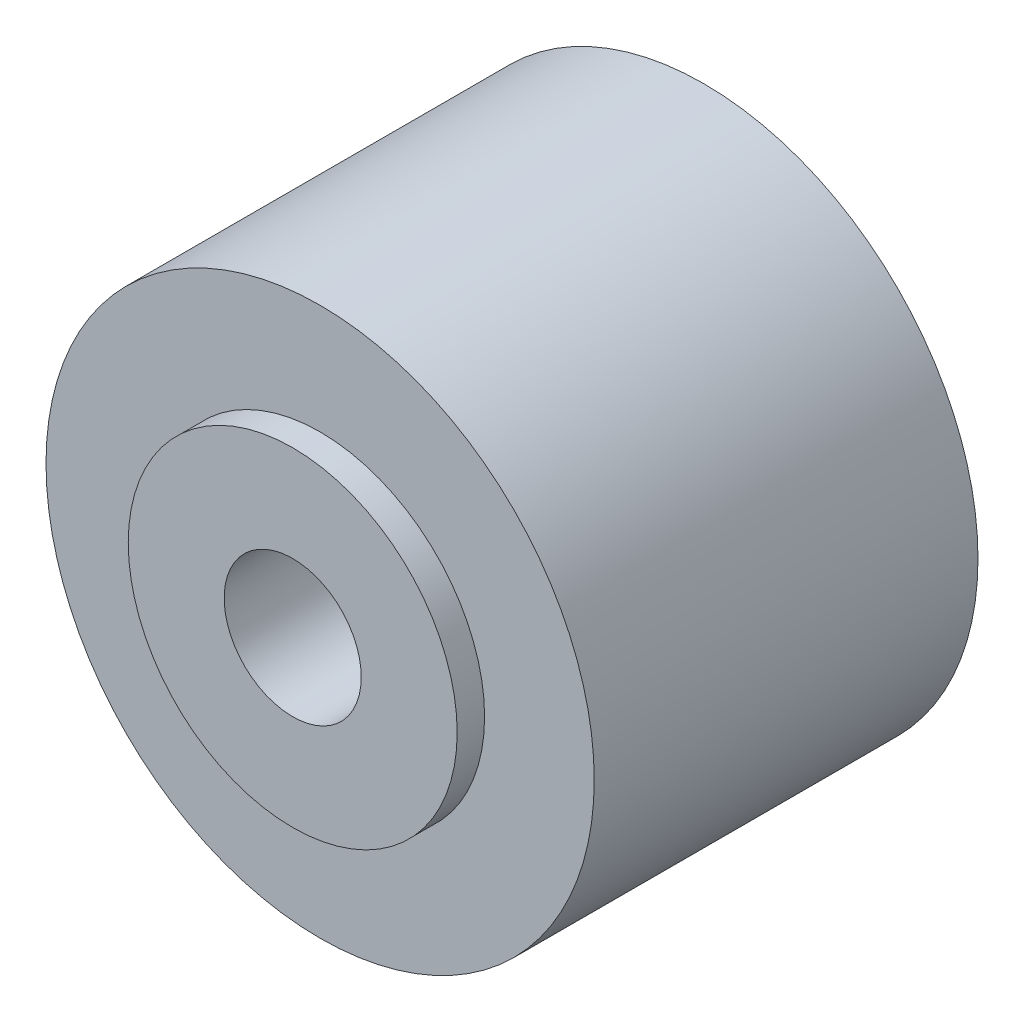
from build123d import *

# Parameters (mm, degrees)
SKETCH1_R           = 3
SKETCH1_R_2         = 1.25
BOSS_EXTRUDE1_DEPTH = 4
SKETCH2_R           = 5
SKETCH2_R_2         = 3
BOSS_EXTRUDE2_DEPTH = 3.5


with BuildPart() as part:
    # Sketch1 → Boss-Extrude1 (new, symmetric)
    with BuildSketch(Plane.XY):
        Circle(SKETCH1_R)
        Circle(SKETCH1_R_2, mode=Mode.SUBTRACT)
    extrude(amount=BOSS_EXTRUDE1_DEPTH, both=True)

    # Sketch2 → Boss-Extrude2 (add, symmetric)
    with BuildSketch(Plane.XY):
        Circle(SKETCH2_R)
        Circle(SKETCH2_R_2, mode=Mode.SUBTRACT)
    extrude(amount=BOSS_EXTRUDE2_DEPTH, both=True)


solid = part.part
